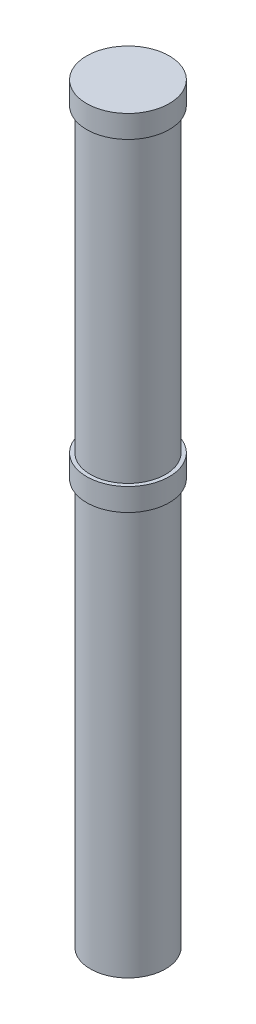
from build123d import *


with BuildPart() as part:
    # Sketch1 → Revolve1 (revolve)
    with BuildSketch(Plane.XY):
        Polygon((-4, -93.199324324), (-5, -93.199324324), (-5, -39.199324324), (-5.5, -39.199324324), (-5.5, -36.199324324), (-5, -36.199324324), (-5, 3.800675676), (-5.5, 3.800675676), (-5.5, 6.800675676), (0, 6.800675676), (0, -68.199324324), (-4, -68.199324324), align=None)
    revolve(axis=Axis((0, 6.800675676, 0), (0, -1, 0)))


solid = part.part
